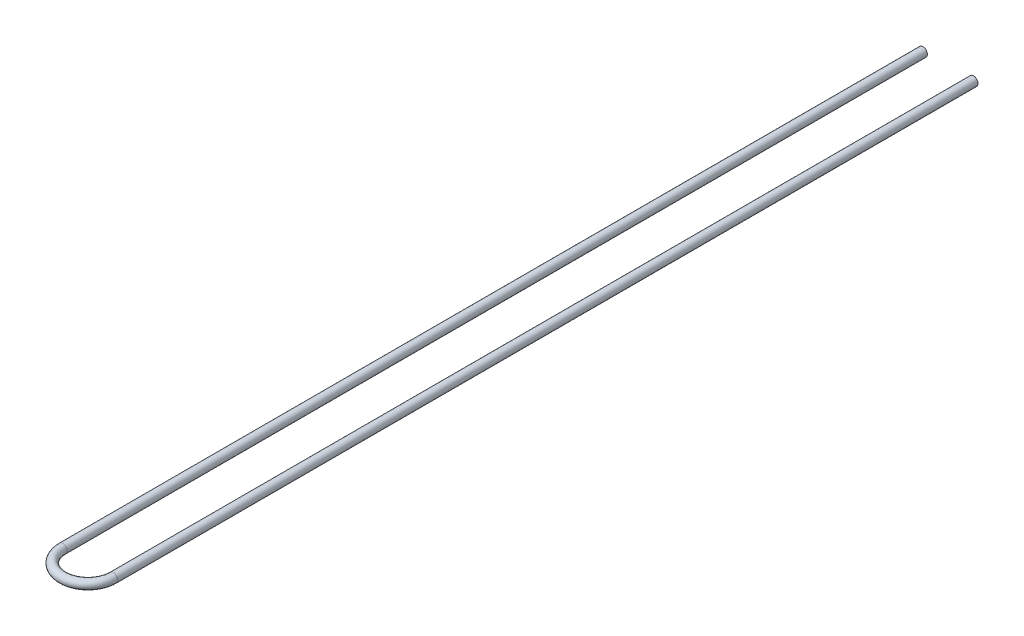
from build123d import *

# Parameters (mm, degrees)
SKETCH2_R   = 11.1
SKETCH2_R_2 = 9.95


with BuildPart() as part:
    # Sweep1: sweep along a path in Sketch1
    with BuildLine(Plane(origin=(0, 0, 0), x_dir=(1, 0, 0), z_dir=(0, 1, 0))) as sweep1_path:
        Line((85.85, -300), (85.85, -2440))
        ThreePointArc((85.85, -2440), (22.925, -2502.925), (-40, -2440))
        Line((-40, -2440), (-40, -300))
    # Sketch2 → Sweep1 (sweep)
    with BuildSketch(Plane(origin=(85.85, 0, 300), x_dir=(-1, 0, 0), z_dir=(0, 0, -1))):
        Circle(SKETCH2_R)
        Circle(SKETCH2_R_2, mode=Mode.SUBTRACT)
    sweep(path=sweep1_path.line)


solid = part.part
